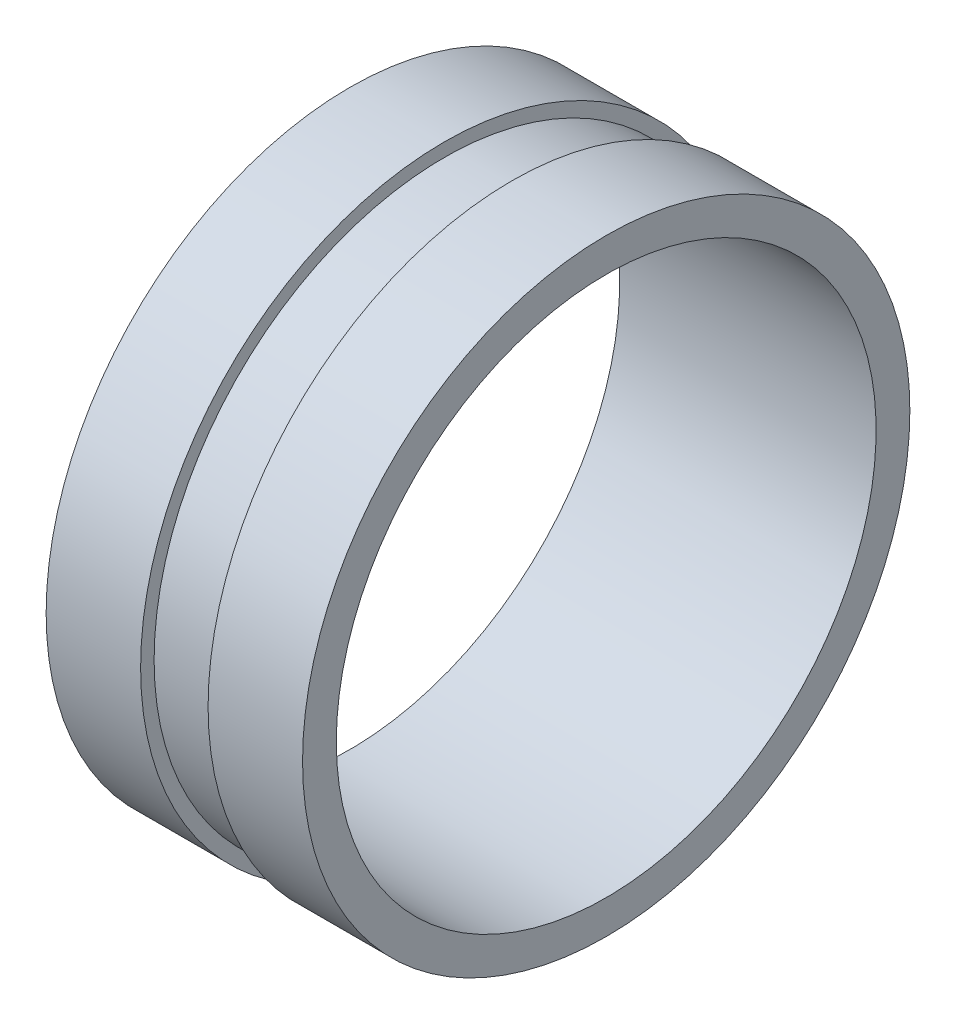
from build123d import *

# Parameters (mm, degrees)
SKETCH1_R           = 28.575
SKETCH1_R_2         = 25.4
BOSS_EXTRUDE1_DEPTH = 24.13


with BuildPart() as part:
    # Sketch1 → Boss-Extrude1 (new body)
    with BuildSketch(Plane(origin=(0, 0, 0), x_dir=(0, 0, -1), z_dir=(1, 0, 0))):
        with Locations(Location((0, 0, 0), (0, 0, 180))):
            Circle(SKETCH1_R)
        with Locations(Location((0, 0, 0), (0, 0, 180))):
            Circle(SKETCH1_R_2, mode=Mode.SUBTRACT)
    extrude(amount=BOSS_EXTRUDE1_DEPTH)

    # Cut-Sweep1: sweep along a curve in space
    with BuildLine() as cut_sweep1_path:
        ThreePointArc((24.13, 0, -28.575), (24.13, 20.205576272, -20.205576272), (24.13, 28.575, 0))
        ThreePointArc((24.13, 28.575, 0), (24.13, 20.205576272, 20.205576272), (24.13, 0, 28.575))
        ThreePointArc((24.13, 0, 28.575), (24.13, -20.205576272, 20.205576272), (24.13, -28.575, 0))
        ThreePointArc((24.13, -28.575, 0), (24.13, -20.205576272, -20.205576272), (24.13, 0, -28.575))
    # Sketch2 → Cut-Sweep1 (sweep, cut)
    with BuildSketch(Plane.XY):
        Polygon((15.24, 28.575), (15.24, 27.305), (8.89, 27.305), (8.89, 28.575), (8.89, 30.628551977), (15.24, 30.628551977), align=None)
    sweep(path=cut_sweep1_path.line, mode=Mode.SUBTRACT)


solid = part.part
